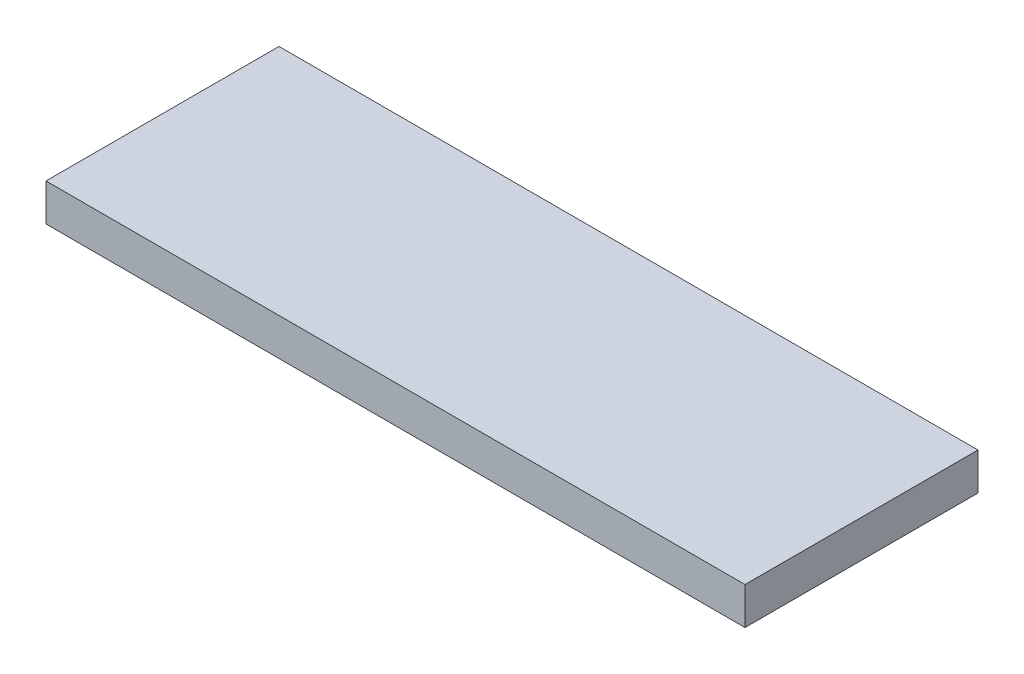
from build123d import *

# Parameters (mm, degrees)
SKETCH1_W           = 1500
SKETCH1_H           = 500
BOSS_EXTRUDE1_DEPTH = 80


with BuildPart() as part:
    # Sketch1 → Boss-Extrude1 (new body)
    with BuildSketch(Plane(origin=(0, 0, 0), x_dir=(1, 0, 0), z_dir=(0, 1, 0))):
        Rectangle(SKETCH1_W, SKETCH1_H)
    extrude(amount=BOSS_EXTRUDE1_DEPTH)


solid = part.part
